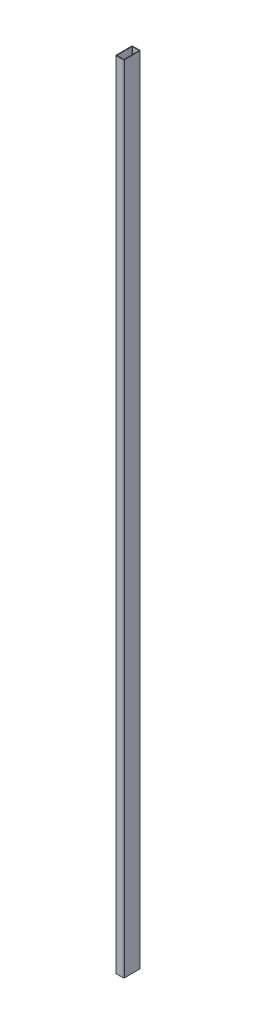
from build123d import *

# Parameters (mm, degrees)
EXTRUDE_1_DEPTH = 1920


with BuildPart() as part:
    # Эскиз1 → Бобышка-Вытянуть1 (new body)
    with BuildSketch(Plane(origin=(0, 0, 0), x_dir=(1, 0, 0), z_dir=(0, 1, 0))):
        with BuildLine():
            Line((0, 18.5), (0, -18.5))
            ThreePointArc((0, -18.5), (0.439339828, -19.560660172), (1.5, -20))
            Line((1.5, -20), (18.5, -20))
            ThreePointArc((18.5, -20), (19.560660172, -19.560660172), (20, -18.5))
            Line((20, -18.5), (20, 18.5))
            ThreePointArc((20, 18.5), (19.560660172, 19.560660172), (18.5, 20))
            Line((18.5, 20), (1.5, 20))
            ThreePointArc((1.5, 20), (0.439339828, 19.560660172), (0, 18.5))
        make_face()
        with BuildLine():
            Line((1.5, 17.5), (1.5, -17.5))
            ThreePointArc((1.5, -17.5), (1.792893219, -18.207106781), (2.5, -18.5))
            Line((2.5, -18.5), (17.5, -18.5))
            ThreePointArc((17.5, -18.5), (18.207106781, -18.207106781), (18.5, -17.5))
            Line((18.5, -17.5), (18.5, 17.5))
            ThreePointArc((18.5, 17.5), (18.207106781, 18.207106781), (17.5, 18.5))
            Line((17.5, 18.5), (2.5, 18.5))
            ThreePointArc((2.5, 18.5), (1.792893219, 18.207106781), (1.5, 17.5))
        make_face(mode=Mode.SUBTRACT)
    extrude(amount=EXTRUDE_1_DEPTH)


solid = part.part
